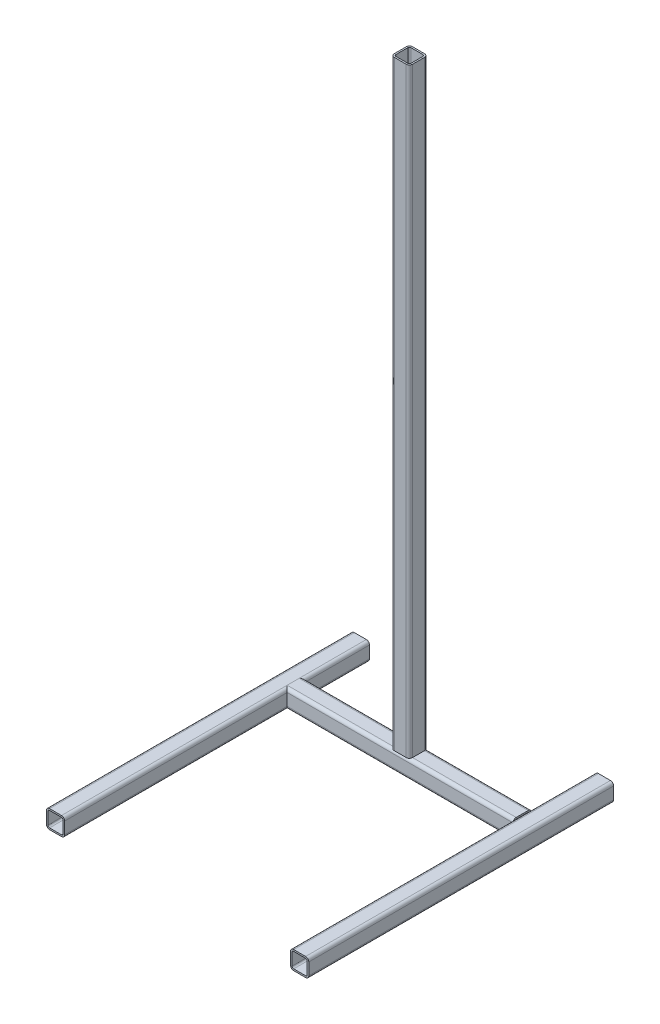
from build123d import *

# Parameters (mm, degrees)
COMPONENTE_ESTRUTURAL1_DEPTH      = 1000
COMPONENTE_ESTRUTURAL1_DEPTH_BACK = 1
COMPONENTE_ESTRUTURAL1_2_DEPTH    = 401
COMPONENTE_ESTRUTURAL1_3_DEPTH    = 500
COMPONENTE_ESTRUTURAL1_4_DEPTH    = 500


with BuildPart() as part:
    # Sketch1 → Componente estrutural1 (new, two sides: drawn at the far end of the back side and taken through both)
    with BuildSketch(Plane(origin=(0, 0, 0), x_dir=(1, 0, 0), z_dir=(0, 1, 0)).offset(-COMPONENTE_ESTRUTURAL1_DEPTH_BACK)):
        with BuildLine():
            Line((-9.8, -15), (9.8, -15))
            ThreePointArc((9.8, -15), (13.476955262, -13.476955262), (15, -9.8))
            Line((15, -9.8), (15, 9.8))
            ThreePointArc((15, 9.8), (13.476955262, 13.476955262), (9.8, 15))
            Line((9.8, 15), (-9.8, 15))
            ThreePointArc((-9.8, 15), (-13.476955262, 13.476955262), (-15, 9.8))
            Line((-15, 9.8), (-15, -9.8))
            ThreePointArc((-15, -9.8), (-13.476955262, -13.476955262), (-9.8, -15))
        make_face()
        with BuildLine():
            Line((-9.8, -12.4), (9.8, -12.4))
            ThreePointArc((9.8, -12.4), (11.638477631, -11.638477631), (12.4, -9.8))
            Line((12.4, -9.8), (12.4, 9.8))
            ThreePointArc((12.4, 9.8), (11.638477631, 11.638477631), (9.8, 12.4))
            Line((9.8, 12.4), (-9.8, 12.4))
            ThreePointArc((-9.8, 12.4), (-11.638477631, 11.638477631), (-12.4, 9.8))
            Line((-12.4, 9.8), (-12.4, -9.8))
            ThreePointArc((-12.4, -9.8), (-11.638477631, -11.638477631), (-9.8, -12.4))
        make_face(mode=Mode.SUBTRACT)
    extrude(amount=COMPONENTE_ESTRUTURAL1_DEPTH + COMPONENTE_ESTRUTURAL1_DEPTH_BACK)

    # Componente estrutural1 end butt 1
    split(bisect_by=Plane(origin=(0, 15, 0), x_dir=(-1, 0, 0), z_dir=(0, 1, 0)), keep=Keep.TOP)


with BuildPart() as body_2:
    # Sketch1 on segment 2 (carried to segment 2) → Componente estrutural1 2 (new body)
    with BuildSketch(Plane(origin=(-200, 0, 0), x_dir=(0, -1, 0), z_dir=(1, 0, 0))):
        with BuildLine():
            Line((-9.8, -15), (9.8, -15))
            ThreePointArc((9.8, -15), (13.476955262, -13.476955262), (15, -9.8))
            Line((15, -9.8), (15, 9.8))
            ThreePointArc((15, 9.8), (13.476955262, 13.476955262), (9.8, 15))
            Line((9.8, 15), (-9.8, 15))
            ThreePointArc((-9.8, 15), (-13.476955262, 13.476955262), (-15, 9.8))
            Line((-15, 9.8), (-15, -9.8))
            ThreePointArc((-15, -9.8), (-13.476955262, -13.476955262), (-9.8, -15))
        make_face()
        with BuildLine():
            Line((-9.8, -12.4), (9.8, -12.4))
            ThreePointArc((9.8, -12.4), (11.638477631, -11.638477631), (12.4, -9.8))
            Line((12.4, -9.8), (12.4, 9.8))
            ThreePointArc((12.4, 9.8), (11.638477631, 11.638477631), (9.8, 12.4))
            Line((9.8, 12.4), (-9.8, 12.4))
            ThreePointArc((-9.8, 12.4), (-11.638477631, 11.638477631), (-12.4, 9.8))
            Line((-12.4, 9.8), (-12.4, -9.8))
            ThreePointArc((-12.4, -9.8), (-11.638477631, -11.638477631), (-9.8, -12.4))
        make_face(mode=Mode.SUBTRACT)
    extrude(amount=COMPONENTE_ESTRUTURAL1_2_DEPTH)

    # Componente estrutural1 2 end butt 1
    split(bisect_by=Plane(origin=(185, 0, 0), x_dir=(0, -1, 0), z_dir=(-1, 0, 0)), keep=Keep.TOP)


with BuildPart() as body_3:
    # Sketch1 on segment 3 (carried to segment 3) → Componente estrutural1 3 (new body)
    with BuildSketch(Plane(origin=(200, 0, 380), x_dir=(1, 0, 0), z_dir=(0, 0, -1))):
        with BuildLine():
            Line((-9.8, -15), (9.8, -15))
            ThreePointArc((9.8, -15), (13.476955262, -13.476955262), (15, -9.8))
            Line((15, -9.8), (15, 9.8))
            ThreePointArc((15, 9.8), (13.476955262, 13.476955262), (9.8, 15))
            Line((9.8, 15), (-9.8, 15))
            ThreePointArc((-9.8, 15), (-13.476955262, 13.476955262), (-15, 9.8))
            Line((-15, 9.8), (-15, -9.8))
            ThreePointArc((-15, -9.8), (-13.476955262, -13.476955262), (-9.8, -15))
        make_face()
        with BuildLine():
            Line((-9.8, -12.4), (9.8, -12.4))
            ThreePointArc((9.8, -12.4), (11.638477631, -11.638477631), (12.4, -9.8))
            Line((12.4, -9.8), (12.4, 9.8))
            ThreePointArc((12.4, 9.8), (11.638477631, 11.638477631), (9.8, 12.4))
            Line((9.8, 12.4), (-9.8, 12.4))
            ThreePointArc((-9.8, 12.4), (-11.638477631, 11.638477631), (-12.4, 9.8))
            Line((-12.4, 9.8), (-12.4, -9.8))
            ThreePointArc((-12.4, -9.8), (-11.638477631, -11.638477631), (-9.8, -12.4))
        make_face(mode=Mode.SUBTRACT)
    extrude(amount=COMPONENTE_ESTRUTURAL1_3_DEPTH)


with BuildPart() as body_4:
    # Sketch1 on segment 4 (carried to segment 4) → Componente estrutural1 4 (new body)
    with BuildSketch(Plane(origin=(-200.454048056, 0, 380), x_dir=(1, 0, 0), z_dir=(0, 0, -1))):
        with BuildLine():
            Line((-9.8, -15), (9.8, -15))
            ThreePointArc((9.8, -15), (13.476955262, -13.476955262), (15, -9.8))
            Line((15, -9.8), (15, 9.8))
            ThreePointArc((15, 9.8), (13.476955262, 13.476955262), (9.8, 15))
            Line((9.8, 15), (-9.8, 15))
            ThreePointArc((-9.8, 15), (-13.476955262, 13.476955262), (-15, 9.8))
            Line((-15, 9.8), (-15, -9.8))
            ThreePointArc((-15, -9.8), (-13.476955262, -13.476955262), (-9.8, -15))
        make_face()
        with BuildLine():
            Line((-9.8, -12.4), (9.8, -12.4))
            ThreePointArc((9.8, -12.4), (11.638477631, -11.638477631), (12.4, -9.8))
            Line((12.4, -9.8), (12.4, 9.8))
            ThreePointArc((12.4, 9.8), (11.638477631, 11.638477631), (9.8, 12.4))
            Line((9.8, 12.4), (-9.8, 12.4))
            ThreePointArc((-9.8, 12.4), (-11.638477631, 11.638477631), (-12.4, 9.8))
            Line((-12.4, 9.8), (-12.4, -9.8))
            ThreePointArc((-12.4, -9.8), (-11.638477631, -11.638477631), (-9.8, -12.4))
        make_face(mode=Mode.SUBTRACT)
    extrude(amount=COMPONENTE_ESTRUTURAL1_4_DEPTH)


solid = Compound([part.part, body_2.part, body_3.part, body_4.part])
